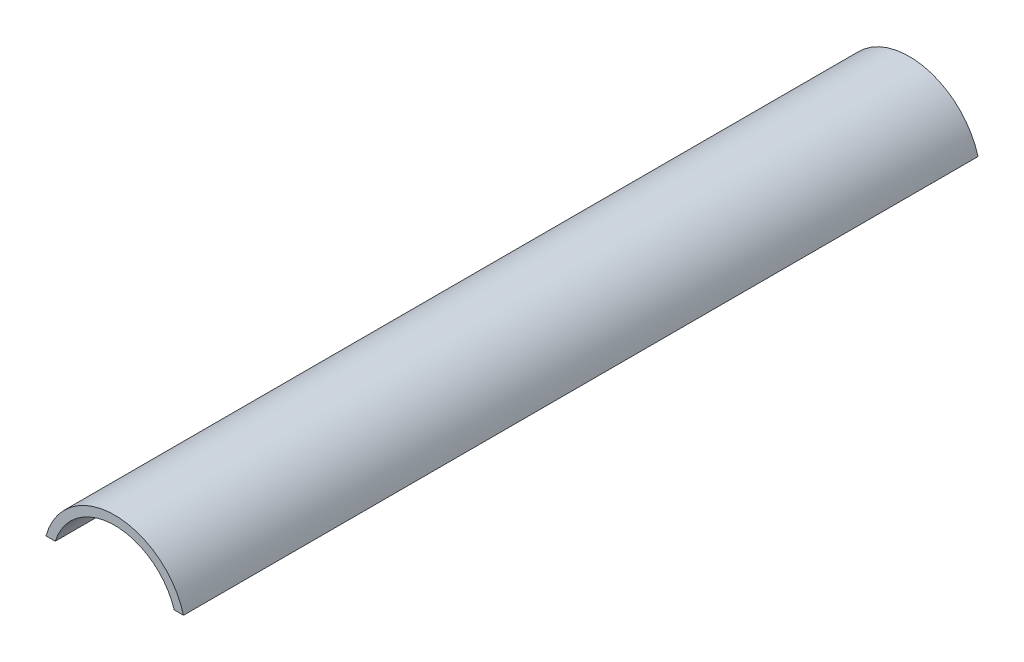
from build123d import *

# Parameters (mm, degrees)
BOSS_EXTRUDE1_DEPTH = 141.5


with BuildPart() as part:
    # Sketch1 → Boss-Extrude1 (new body)
    with BuildSketch(Plane.XY):
        with BuildLine():
            Line((-12.244571551, 3.370529267), (-10.596883148, 3.370529267))
            ThreePointArc((-10.596883148, 3.370529267), (0, 11.12), (10.596883148, 3.370529267))
            Line((10.596883148, 3.370529267), (12.244571551, 3.370529267))
            ThreePointArc((12.244571551, 3.370529267), (0, 12.7), (-12.244571551, 3.370529267))
        make_face()
    extrude(amount=BOSS_EXTRUDE1_DEPTH)


solid = part.part
